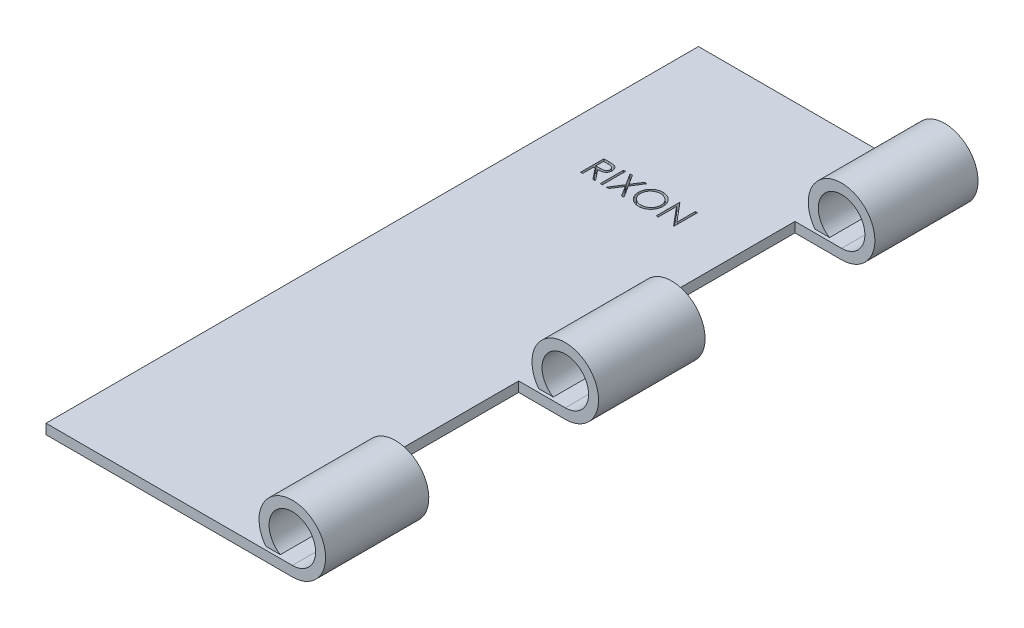
from build123d import *

# Parameters (mm, degrees)
BOSS_EXTRUDE1_DEPTH = 98
SKETCH2_W           = 20.165812667
SKETCH2_H           = 25.5
CUT_EXTRUDE1_DEPTH  = 108.088748242
SKETCH5_W           = 0.314102564
SKETCH5_H           = 3.5
CUT_EXTRUDE3_DEPTH  = 1


with BuildPart() as part:
    # Sketch1 → Boss-Extrude1 (new body)
    with BuildSketch(Plane.XY):
        with BuildLine():
            Line((0, 0), (30, 0))
            Line((30, 0), (32, 0))
            Line((32, 0), (37, 0))
            ThreePointArc((37, 0), (39.236067977, 9.472135955), (33, 2))
            Line((33, 2), (35.197224362, 2))
            ThreePointArc((35.197224362, 2), (37.935414347, 8.372684391), (37, 1.5))
            Line((37, 1.5), (32, 1.5))
            Line((32, 1.5), (30, 1.5))
            Line((30, 1.5), (0, 1.5))
            Line((0, 1.5), (0, 0))
        make_face()
    extrude(amount=BOSS_EXTRUDE1_DEPTH)

    # Sketch2 → Cut-Extrude1 (cut, through all)
    with BuildSketch(Plane.XZ):
        with Locations((40.082906334, 28.25)):
            Rectangle(SKETCH2_W, SKETCH2_H)
        with Locations((40.082906334, 69.75)):
            Rectangle(SKETCH2_W, SKETCH2_H)
    extrude(amount=-CUT_EXTRUDE1_DEPTH, mode=Mode.SUBTRACT)

    # Sketch5 → Cut-Extrude3 (cut)
    # profile 1 of 5: a face of its own
    with BuildSketch(Plane(origin=(0, 1.5, 0), x_dir=(1, 0, 0), z_dir=(0, 1, 0))):
        with BuildLine():
            Line((7.498786947, -21.704814254), (8.19920762, -21.704814254))
            add(Edge.make_bspline(
                [(8.19920762, -21.704814254), (8.245948749, -21.70496984), (8.335696893, -21.705268582), (8.464270163, -21.706934345), (8.58109726, -21.711708701), (8.6861171, -21.715817284), (8.779327755, -21.723309226), (8.861015046, -21.730469873), (8.930802743, -21.739843534), (8.973048594, -21.748548957), (8.99217637, -21.752490536)],
                knots=[0, 0, 0, 0, 1.410062039, 2.707475311, 3.878576406, 4.937260626, 5.877586885, 6.699081471, 7.410979367, 8, 8, 8, 8], degree=3))
            add(Edge.make_bspline(
                [(8.99217637, -21.752490536), (9.017782994, -21.758817301), (9.068449984, -21.771335865), (9.14140005, -21.797795466), (9.210914374, -21.828415091), (9.276704198, -21.864378811), (9.338439989, -21.905953591), (9.3967583, -21.952421713), (9.451923763, -22.003528919), (9.501705394, -22.06056376), (9.548644445, -22.12040027), (9.588233072, -22.185104027), (9.622359552, -22.252765554), (9.649530069, -22.324072972), (9.671408042, -22.398334744), (9.686834281, -22.476223541), (9.696085469, -22.557384516), (9.697027325, -22.612742425), (9.697504896, -22.64081185)],
                knots=[0, 0, 0, 0, 1.027469482, 2.033020251, 3.019912614, 3.986113645, 4.951240523, 5.91722682, 6.890402269, 7.87763091, 8.8651537, 9.85103654, 10.82876324, 11.815024772, 12.821070561, 13.842952187, 14.906261191, 16, 16, 16, 16], degree=3))
            add(Edge.make_bspline(
                [(9.697504896, -22.64081185), (9.696035898, -22.687446955), (9.693169502, -22.778444123), (9.666444398, -22.910505004), (9.622667879, -23.033694319), (9.56234459, -23.147856957), (9.485525114, -23.250767602), (9.393200323, -23.341158057), (9.285318711, -23.41679797), (9.184889395, -23.469250775), (9.096175196, -23.502843683), (9.023141883, -23.526480042), (8.943474905, -23.544742007), (8.857937571, -23.561102139), (8.766173915, -23.573453834), (8.668403876, -23.582500428), (8.564557724, -23.588154477), (8.493218655, -23.588996482), (8.456519319, -23.589429639)],
                knots=[0, 0, 0, 0, 1.260483769, 2.459530307, 3.627416485, 4.787058657, 5.939039949, 7.08810263, 8.267026773, 9.491475466, 10.141966685, 10.831826277, 11.566392101, 12.351337768, 13.187381173, 14.07005841, 15.007169909, 16, 16, 16, 16], degree=3))
            Line((8.456519319, -23.589429639), (9.742376691, -25.204814254))
            Line((9.742376691, -25.204814254), (9.353955216, -25.204814254))
            Line((9.353955216, -25.204814254), (8.068097845, -23.589429639))
            Line((8.068097845, -23.589429639), (7.812889511, -23.589429639))
            Line((7.812889511, -23.589429639), (7.812889511, -25.204814254))
            Line((7.812889511, -25.204814254), (7.498786947, -25.204814254))
            Line((7.498786947, -25.204814254), (7.498786947, -21.704814254))
        make_face()
        with BuildLine():
            Line((7.812889511, -22.063788613), (7.812889511, -23.23045528))
            Line((7.812889511, -23.23045528), (8.453714832, -23.235363132))
            add(Edge.make_bspline(
                [(8.453714832, -23.235363132), (8.483634871, -23.235376369), (8.541628428, -23.235402025), (8.625529093, -23.231408249), (8.703649204, -23.226864931), (8.775689956, -23.219915585), (8.841683532, -23.210959514), (8.901596945, -23.199756529), (8.955527997, -23.186704467), (9.018426535, -23.166502841), (9.088663067, -23.134496823), (9.164994527, -23.087931324), (9.229996864, -23.029362205), (9.284914727, -22.962388749), (9.329044158, -22.8887525), (9.360156212, -22.809336131), (9.379898655, -22.726144533), (9.3822272, -22.668966425), (9.383402332, -22.640110728)],
                knots=[0, 0, 0, 0, 1.146690395, 2.22261258, 3.21895312, 4.145990853, 4.996080663, 5.770904154, 6.481378293, 7.121626537, 8.300444488, 9.431385265, 10.535395872, 11.636531494, 12.74115979, 13.810798291, 14.895190096, 16, 16, 16, 16], degree=3))
            add(Edge.make_bspline(
                [(9.383402332, -22.640110728), (9.382200211, -22.611964155), (9.379818045, -22.556187916), (9.360369277, -22.474532006), (9.327479895, -22.397465056), (9.283157658, -22.325300571), (9.229158503, -22.259794835), (9.16584069, -22.203747682), (9.094935495, -22.157498217), (9.028664296, -22.127943836), (8.969430084, -22.109823983), (8.918000424, -22.097072819), (8.859888946, -22.08682835), (8.794813487, -22.07862029), (8.723051857, -22.071565345), (8.644241206, -22.066813567), (8.558904425, -22.063999703), (8.499757494, -22.063860614), (8.469139511, -22.063788613)],
                knots=[0, 0, 0, 0, 1.101028733, 2.181837193, 3.264309656, 4.369019818, 5.486613113, 6.575447106, 7.666700264, 8.788928104, 9.402425223, 10.0903467, 10.862060571, 11.710948788, 12.657782767, 13.684531032, 14.801375019, 16, 16, 16, 16], degree=3))
            Line((8.469139511, -22.063788613), (7.812889511, -22.063788613))
        make_face(mode=Mode.SUBTRACT)
    # profile 2 of 5: a face of its own
    with BuildSketch(Plane(origin=(0, 1.5, 0), x_dir=(1, 0, 0), z_dir=(0, 1, 0))):
        with Locations((10.617376691, -23.454814254)):
            Rectangle(SKETCH5_W, SKETCH5_H)
    # profile 3 of 5: a face of its own
    with BuildSketch(Plane(origin=(0, 1.5, 0), x_dir=(1, 0, 0), z_dir=(0, 1, 0))):
        Polygon((11.425068998, -21.704814254), (11.787548966, -21.704814254), (12.703915152, -23.136504959), (13.620281338, -21.704814254), (13.982761306, -21.704814254), (12.885505697, -23.419758164), (14.027633101, -25.204814254), (13.665153133, -25.204814254), (12.703915152, -23.703011369), (11.742677171, -25.204814254), (11.380197204, -25.204814254), (12.523025729, -23.419758164), align=None)
    # profile 4 of 5: a face of its own
    with BuildSketch(Plane(origin=(0, 1.5, 0), x_dir=(1, 0, 0), z_dir=(0, 1, 0))):
        with BuildLine():
            add(Edge.make_bspline(
                [(16.271222845, -21.615070664), (16.33603095, -21.616712144), (16.463319417, -21.619936145), (16.650394315, -21.644615248), (16.82898941, -21.687310638), (17.000559549, -21.744173621), (17.163052526, -21.820028006), (17.317691418, -21.911713154), (17.464108292, -22.020189613), (17.600329674, -22.14461884), (17.724986624, -22.280002294), (17.83481251, -22.424480204), (17.926854804, -22.577179006), (18.002440591, -22.737639837), (18.061739201, -22.905499805), (18.102658244, -23.081653808), (18.128796395, -23.264960498), (18.131852172, -23.389987362), (18.133402332, -23.45341201)],
                knots=[0, 0, 0, 0, 1.065120563, 2.091984664, 3.0946048, 4.079830382, 5.057816894, 6.036188127, 7.030412546, 8.04752943, 9.064399622, 10.05169764, 11.02544977, 11.989514704, 12.962713494, 13.945757189, 14.957906945, 16, 16, 16, 16], degree=3))
            add(Edge.make_bspline(
                [(18.133402332, -23.45341201), (18.131852399, -23.516369457), (18.128797303, -23.640465877), (18.102628525, -23.822609321), (18.061587525, -23.997700018), (18.002991259, -24.165445671), (17.927765781, -24.326023234), (17.835110609, -24.479010188), (17.725969399, -24.624456687), (17.601762548, -24.760769352), (17.466361506, -24.885766823), (17.321131239, -24.994685698), (17.169337919, -25.088409823), (17.009028211, -25.163193497), (16.842328174, -25.222965417), (16.667745851, -25.263718047), (16.486099297, -25.290005091), (16.362228293, -25.293023607), (16.299267716, -25.294557844)],
                knots=[0, 0, 0, 0, 1.043624062, 2.057103931, 3.04512605, 4.022047818, 4.998200453, 5.980619268, 6.982898556, 8.009068085, 9.034988726, 10.034168286, 11.015286542, 11.987931943, 12.962482838, 13.94673481, 14.956375938, 16, 16, 16, 16], degree=3))
            add(Edge.make_bspline(
                [(16.299267716, -25.294557844), (16.235843397, -25.293008457), (16.110817181, -25.289954203), (15.927280146, -25.263772798), (15.751002402, -25.222831494), (15.582488051, -25.164322058), (15.421643121, -25.088704827), (15.268153039, -24.996500448), (15.122633891, -24.887093307), (14.986292145, -24.762926733), (14.861542947, -24.627755181), (14.752783571, -24.482920926), (14.660558458, -24.331265469), (14.585195125, -24.172367945), (14.525530666, -24.006996502), (14.484825848, -23.834048025), (14.458489896, -23.654508519), (14.455455049, -23.53226562), (14.453915152, -23.470238934)],
                knots=[0, 0, 0, 0, 1.053102029, 2.075944431, 3.073151272, 4.055350789, 5.033113405, 6.020478099, 7.024410459, 8.052272461, 9.079885166, 10.07527673, 11.055994387, 12.023226415, 12.992069828, 13.970394897, 14.97016774, 16, 16, 16, 16], degree=3))
            add(Edge.make_bspline(
                [(14.453915152, -23.470238934), (14.454449788, -23.428606264), (14.455512314, -23.345866141), (14.468304007, -23.222999541), (14.486865708, -23.102108883), (14.51346762, -22.983537935), (14.548259287, -22.86757695), (14.589311315, -22.753426187), (14.63945116, -22.642242464), (14.696131808, -22.533499072), (14.759393616, -22.428891166), (14.829269366, -22.330011583), (14.903304734, -22.236030586), (14.984468128, -22.149383582), (15.070084573, -22.067549926), (15.161542951, -21.991787209), (15.258285195, -21.921412258), (15.360727575, -21.857991917), (15.46634585, -21.800632782), (15.575222628, -21.751410931), (15.685879199, -21.70916487), (15.798833847, -21.674924045), (15.913786619, -21.647892009), (16.030988404, -21.629484655), (16.15034583, -21.616660337), (16.230757149, -21.615602835), (16.271222845, -21.615070664)],
                knots=[0, 0, 0, 0, 1.037015668, 2.060948919, 3.074880161, 4.083647147, 5.086022904, 6.090072063, 7.104153813, 8.122640571, 9.144368836, 10.147691507, 11.138137339, 12.123020368, 13.103399296, 14.087645067, 15.080126199, 16.082011238, 17.087798457, 18.072939717, 19.057185487, 20.037253025, 21.01195951, 21.997135196, 22.992090687, 24, 24, 24, 24], degree=3))
        make_face()
        with BuildLine():
            add(Edge.make_bspline(
                [(16.286647524, -21.974045023), (16.253432891, -21.974449914), (16.187321158, -21.975255823), (16.089036621, -21.985871539), (15.992044687, -22.001001428), (15.896325325, -22.022582949), (15.802279036, -22.051987001), (15.709029195, -22.08582791), (15.617426141, -22.127049), (15.527772283, -22.173621704), (15.440857208, -22.225170625), (15.358844506, -22.282142392), (15.281521862, -22.343200947), (15.209078596, -22.408488784), (15.141727424, -22.478338386), (15.078142722, -22.551690822), (15.020873141, -22.630642713), (14.968387564, -22.71305312), (14.921419723, -22.798814701), (14.879654369, -22.887024563), (14.84549036, -22.97840225), (14.817627984, -23.071956408), (14.794528173, -23.167538867), (14.779894249, -23.265874716), (14.769161889, -23.366469828), (14.768402044, -23.434451682), (14.768017716, -23.46883669)],
                knots=[0, 0, 0, 0, 1.008559885, 2.007477868, 2.99961109, 3.989939068, 4.984837346, 5.991145699, 7.001802488, 8.033829008, 9.059044045, 10.069351652, 11.065060232, 12.050310815, 13.029377138, 14.011219647, 14.996725999, 15.989392538, 16.977580475, 17.965360261, 18.951710183, 19.937753436, 20.929683414, 21.935841486, 22.955955122, 24, 24, 24, 24], degree=3))
            add(Edge.make_bspline(
                [(14.768017716, -23.46883669), (14.769292578, -23.519398911), (14.771800626, -23.618870441), (14.793758196, -23.764638585), (14.827580171, -23.904726871), (14.877437537, -24.038368781), (14.939788152, -24.166713063), (15.016815042, -24.288621168), (15.108074128, -24.404126042), (15.211737654, -24.512421311), (15.325060361, -24.611267116), (15.445393091, -24.698030524), (15.571446698, -24.771440774), (15.703549901, -24.831245846), (15.84099744, -24.878635584), (15.984674991, -24.911114215), (16.133625451, -24.932489671), (16.235156106, -24.934542427), (16.286647524, -24.935583485)],
                knots=[0, 0, 0, 0, 1.032063989, 2.030389145, 3.003944642, 3.970395727, 4.937377036, 5.913328081, 6.909231446, 7.93887556, 8.970685674, 9.976071282, 10.964166581, 11.944589148, 12.933237628, 13.927779006, 14.949070134, 16, 16, 16, 16], degree=3))
            add(Edge.make_bspline(
                [(16.286647524, -24.935583485), (16.321257026, -24.93510798), (16.389898062, -24.934164912), (16.491993584, -24.924666236), (16.592249796, -24.909434366), (16.690526076, -24.887503711), (16.786710887, -24.860056504), (16.881205691, -24.827448776), (16.973003981, -24.786767573), (17.063263819, -24.741819621), (17.14966006, -24.690579463), (17.232135593, -24.635541314), (17.308611572, -24.574572693), (17.381000644, -24.510254881), (17.448628333, -24.441291033), (17.511037317, -24.367770811), (17.568017449, -24.289230154), (17.620483096, -24.206944748), (17.667286359, -24.120948495), (17.708065458, -24.032418817), (17.742661574, -23.941573708), (17.770590078, -23.848282136), (17.79247554, -23.752721288), (17.80755546, -23.654763209), (17.818103899, -23.554603867), (17.818898976, -23.486860011), (17.819299768, -23.452710889)],
                knots=[0, 0, 0, 0, 1.047197238, 2.076906641, 3.100256066, 4.114471768, 5.12198147, 6.126382909, 7.136867548, 8.15857795, 9.17633901, 10.174870724, 11.156907918, 12.133735059, 13.104061851, 14.077631395, 15.04955518, 16.038496417, 17.029181396, 18.010275684, 18.986308667, 19.968651475, 20.955262928, 21.950658345, 22.966943676, 24, 24, 24, 24], degree=3))
            add(Edge.make_bspline(
                [(17.819299768, -23.452710889), (17.818898655, -23.418795384), (17.818102973, -23.351517734), (17.807560499, -23.252056916), (17.792459608, -23.154803704), (17.7706969, -23.060139901), (17.742646746, -22.968041376), (17.708059416, -22.878594629), (17.667274117, -22.791466434), (17.620465892, -22.706872137), (17.567850069, -22.625697399), (17.510355825, -22.548094986), (17.446990477, -22.475522245), (17.379564452, -22.406187551), (17.306393567, -22.341569661), (17.227809273, -22.28164714), (17.144765595, -22.224973866), (17.05683836, -22.173848304), (16.966094406, -22.126634072), (16.872980448, -22.086183068), (16.778551348, -22.051810949), (16.683047236, -22.022493984), (16.585664258, -22.001085954), (16.487060429, -21.985857904), (16.38737217, -21.975259518), (16.320328951, -21.97445114), (16.286647524, -21.974045023)],
                knots=[0, 0, 0, 0, 1.02996197, 2.043119294, 3.035359645, 4.018872909, 4.991431989, 5.957985074, 6.929999688, 7.912076566, 8.892894881, 9.867085534, 10.843653904, 11.817741046, 12.803660682, 13.806313499, 14.818574707, 15.856120519, 16.894564902, 17.924820532, 18.937903209, 19.946497019, 20.957711757, 21.963978472, 22.977135795, 24, 24, 24, 24], degree=3))
        make_face(mode=Mode.SUBTRACT)
    # profile 5 of 5: a face of its own
    with BuildSketch(Plane(origin=(0, 1.5, 0), x_dir=(1, 0, 0), z_dir=(0, 1, 0))):
        Polygon((18.85135105, -25.204814254), (18.85135105, -21.704814254), (18.917256498, -21.704814254), (21.229556178, -24.459521786), (21.229556178, -21.704814254), (21.543658742, -21.704814254), (21.543658742, -25.204814254), (21.472144319, -25.204814254), (19.165453614, -22.456416818), (19.165453614, -25.204814254), align=None)
    extrude(amount=-CUT_EXTRUDE3_DEPTH, mode=Mode.SUBTRACT)


solid = part.part
